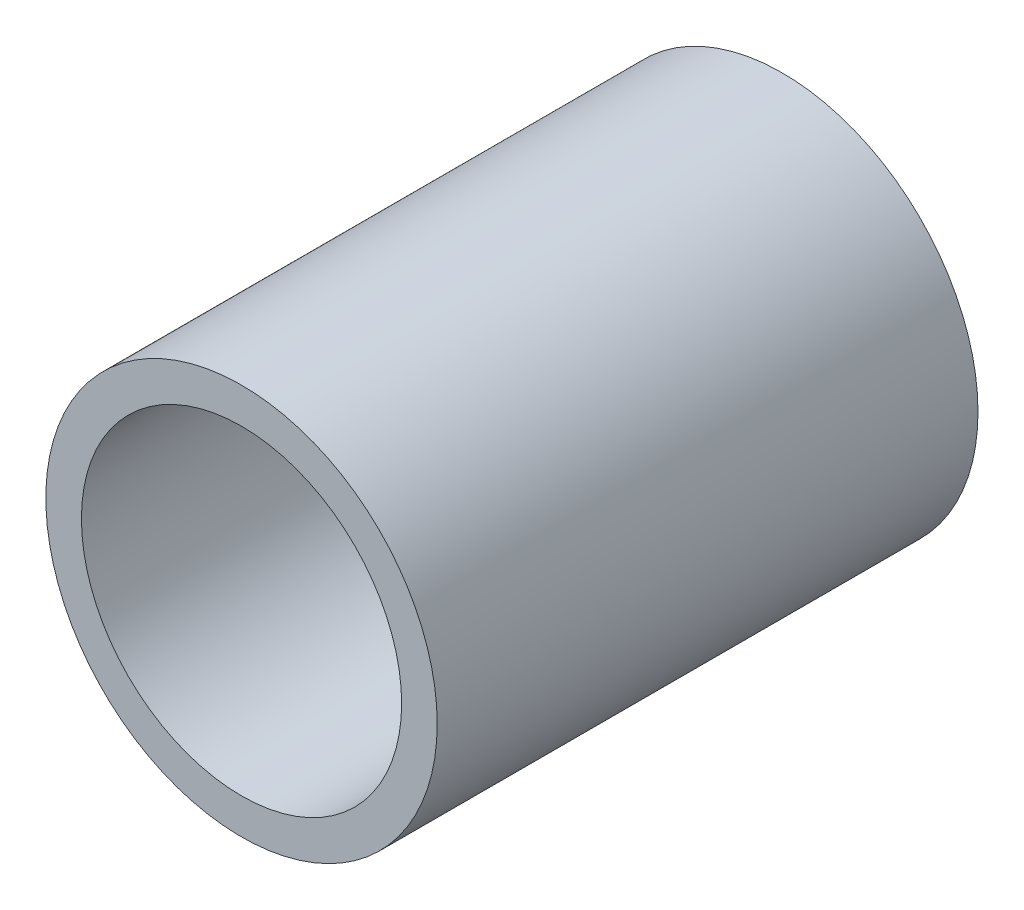
from build123d import *

# Parameters (mm, degrees)
SKETCH1_R           = 2.75
SKETCH1_R_2         = 2.25
BOSS_EXTRUDE1_DEPTH = 7.6
SCALE1_SCALE        = 1.5


with BuildPart() as part:
    # Sketch1 → Boss-Extrude1 (new body)
    with BuildSketch(Plane.XY):
        Circle(SKETCH1_R)
        Circle(SKETCH1_R_2, mode=Mode.SUBTRACT)
    extrude(amount=-BOSS_EXTRUDE1_DEPTH)


with BuildPart() as part_1:
    # Scale1: scaled about (0, 0, 0)
    add(part.part.scale(SCALE1_SCALE))


solid = part_1.part
